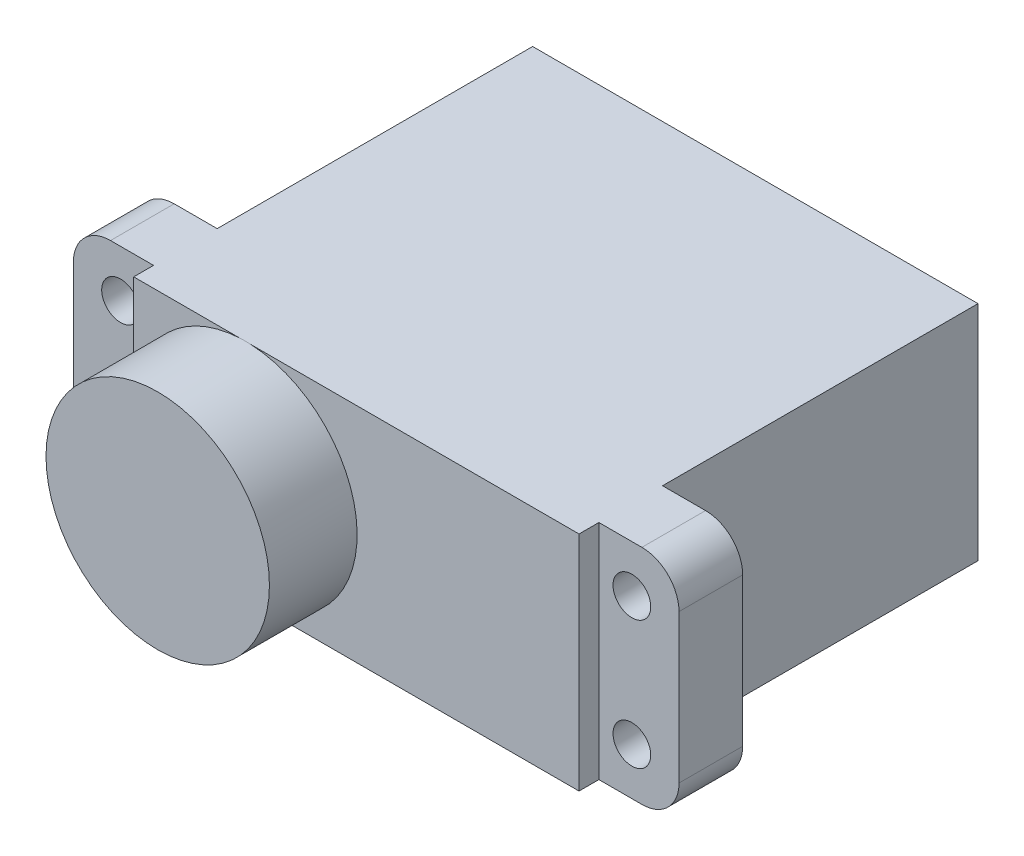
from build123d import *

# Parameters (mm, degrees)
SKETCH1_W            = 24
SKETCH1_H            = 12
EXTRUDE1_DEPTH       = 21.5
SKETCH2_W            = 3.43
SKETCH2_H            = 12
EXTRUDE2_DEPTH       = 4.318
FILLET1_R            = 2
FILLET2_R            = 2
SKETCH3_R            = 1.016
CUT_EXTRUDE1_DEPTH   = 4.318
FILLET1_OF_MIRROR1_R = 2
FILLET2_OF_MIRROR1_R = 2
SKETCH4_R            = 6.02
EXTRUDE3_DEPTH       = 4.725


with BuildPart() as part:
    # Sketch1 → Extrude1 (new body)
    with BuildSketch(Plane.XY):
        with Locations((-12, 6)):
            Rectangle(SKETCH1_W, SKETCH1_H)
    extrude(amount=EXTRUDE1_DEPTH)

    # Sketch2 → Extrude2 (add)
    with BuildSketch(Plane.ZY.offset(24)):
        with Locations((18.715, 6)):
            Rectangle(SKETCH2_W, SKETCH2_H)
    extrude2 = extrude(amount=EXTRUDE2_DEPTH)

    # Fillet1
    fillet1_edges = [part.edges().sort_by_distance(p)[0] for p in [
        (-28.318, 12, 18.715),
    ]]
    fillet(fillet1_edges, radius=FILLET1_R)

    # Fillet2
    fillet2_edges = [part.edges().sort_by_distance(p)[0] for p in [
        (-28.318, 0, 18.715),
    ]]
    fillet(fillet2_edges, radius=FILLET2_R)

    # Sketch3 → Cut-Extrude1 (cut)
    with BuildSketch(Plane.XY.offset(20.43)):
        with Locations((-25.778, 2.53620247)):
            Circle(SKETCH3_R)
        with Locations((-25.778, 9.46)):
            Circle(SKETCH3_R)
    cut_extrude1 = extrude(amount=-CUT_EXTRUDE1_DEPTH, mode=Mode.SUBTRACT)

    # Mirror1: Extrude2, Cut-Extrude1 across plane
    add(extrude2.mirror(Plane.ZY.offset(12)))
    add(cut_extrude1.mirror(Plane.ZY.offset(12)), mode=Mode.SUBTRACT)

    # Fillet1 of Mirror1
    fillet1_of_mirror1_edges = [part.edges().sort_by_distance(p)[0] for p in [
        (4.318, 12, 18.715),
    ]]
    fillet(fillet1_of_mirror1_edges, radius=FILLET1_OF_MIRROR1_R)

    # Fillet2 of Mirror1
    fillet2_of_mirror1_edges = [part.edges().sort_by_distance(p)[0] for p in [
        (4.318, 0, 18.715),
    ]]
    fillet(fillet2_of_mirror1_edges, radius=FILLET2_OF_MIRROR1_R)

    # Sketch4 → Extrude3 (add)
    with BuildSketch(Plane.XY.offset(21.5)):
        with Locations(Location((-17.98, 5.987133141, 0), (0, 0, 180))):
            Circle(SKETCH4_R)
    extrude(amount=EXTRUDE3_DEPTH)


solid = part.part
